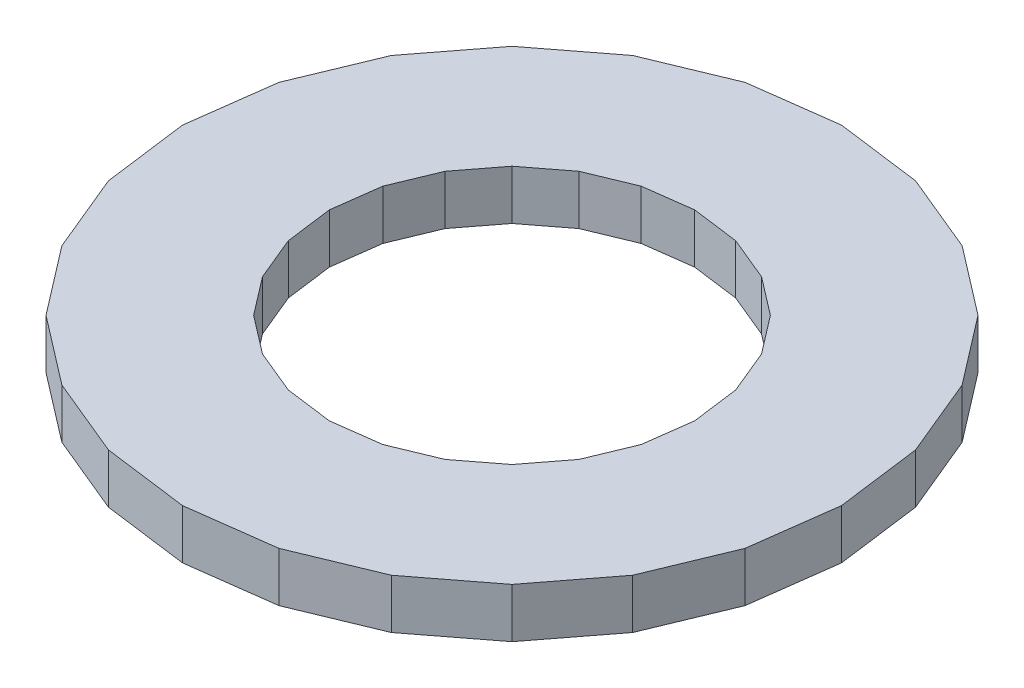
from build123d import *

# Parameters (mm, degrees)
BOSS_EXTRUDE3_DEPTH = 19.05


with BuildPart() as part:
    # Sketch3 → Boss-Extrude3 (new body)
    with BuildSketch(Plane(origin=(0, 0, 0), x_dir=(1, 0, 0), z_dir=(0, 1, 0))):
        Polygon((-126.488022972, 0), (-122.178048105, -32.737509323), (-109.541841168, -63.244011486), (-89.440538783, -89.440538783), (-63.244011486, -109.541841168), (-32.737509323, -122.178048105), (0, -126.488022972), (32.737509323, -122.178048105), (63.244011486, -109.541841168), (89.440538783, -89.440538783), (109.541841168, -63.244011486), (122.178048105, -32.737509323), (126.488022972, 0), (122.178048105, 32.737509323), (109.541841168, 63.244011486), (89.440538783, 89.440538783), (63.244011486, 109.541841168), (32.737509323, 122.178048105), (0, 126.488022972), (-32.737509323, 122.178048105), (-63.244011486, 109.541841168), (-89.440538783, 89.440538783), (-109.541841168, 63.244011486), (-122.178048105, 32.737509323), align=None)
        Polygon((-70.125836655, 0), (-67.736356715, -18.14990208), (-60.730756005, -35.062918327), (-49.586454635, -49.586454635), (-35.062918327, -60.730756005), (-18.14990208, -67.736356715), (0, -70.125836655), (18.14990208, -67.736356715), (35.062918327, -60.730756005), (49.586454635, -49.586454635), (60.730756005, -35.062918327), (67.736356715, -18.14990208), (70.125836655, 0), (67.736356715, 18.14990208), (60.730756005, 35.062918327), (49.586454635, 49.586454635), (35.062918327, 60.730756005), (18.14990208, 67.736356715), (0, 70.125836655), (-18.14990208, 67.736356715), (-35.062918327, 60.730756005), (-49.586454635, 49.586454635), (-60.730756005, 35.062918327), (-67.736356715, 18.14990208), align=None, mode=Mode.SUBTRACT)
    extrude(amount=BOSS_EXTRUDE3_DEPTH)


solid = part.part
